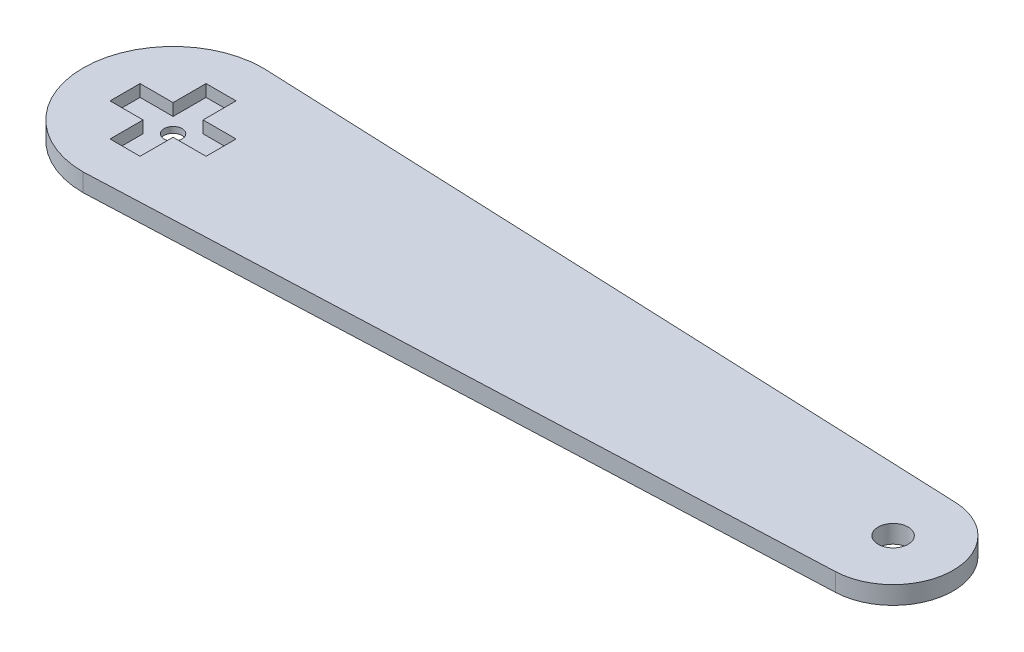
from build123d import *

# Parameters (mm, degrees)
SKETCH_1_R          = 5
EXTRUDE_1_DEPTH     = 3
SKETCH_2_R          = 2.5
CUT_EXTRUDE_1_DEPTH = 131.896905999
EXTRUDE_START       = -3
SKETCH_3_R          = 5
EXTRUDE_2_DEPTH     = 3
SKETCH_4_R          = 1.5
CUT_EXTRUDE_2_DEPTH = 3
SKETCH_5_W          = 5
SKETCH_5_H          = 5.5
SKETCH_5_W_2        = 5.5
SKETCH_5_H_2        = 5
SKETCH_5_R          = 1.5
CUT_EXTRUDE_3_DEPTH = 2


with BuildPart() as part:
    # 草图1 → 凸台-拉伸1 (new body)
    with BuildSketch(Plane(origin=(0, 0, 0), x_dir=(1, 0, 0), z_dir=(0, 1, 0))):
        with BuildLine():
            Line((0, -15), (120.415586748, -9.991360651))
            ThreePointArc((120.415586748, -9.991360651), (130, 0), (120.415586748, 9.991360651))
            Line((120.415586748, 9.991360651), (0, 15))
            ThreePointArc((0, 15), (-15, 0), (0, -15))
        make_face()
        with Locations(Location((0, 0, 0), (0, 0, 270))):
            Circle(SKETCH_1_R, mode=Mode.SUBTRACT)
    extrude(amount=EXTRUDE_1_DEPTH)

    # 草图2 → 切除-拉伸1 (cut, through all)
    with BuildSketch(Plane(origin=(0, 3, 0), x_dir=(1, 0, 0), z_dir=(0, 1, 0))):
        with Locations(Location((120, 0, 0), (0, 0, 270))):
            Circle(SKETCH_2_R)
    extrude(amount=-CUT_EXTRUDE_1_DEPTH, mode=Mode.SUBTRACT)

    # 草图3 → 凸台-拉伸2 (add)
    with BuildSketch(Plane(origin=(0, 3, 0), x_dir=(1, 0, 0), z_dir=(0, 1, 0)).offset(EXTRUDE_START)):
        Circle(SKETCH_3_R)
    extrude(amount=EXTRUDE_2_DEPTH)

    # 草图4 → 切除-拉伸2 (cut)
    with BuildSketch(Plane(origin=(0, 3, 0), x_dir=(1, 0, 0), z_dir=(0, 1, 0))):
        with Locations(Location((0, 0, 0), (0, 0, 270))):
            Circle(SKETCH_4_R)
    extrude(amount=-CUT_EXTRUDE_2_DEPTH, mode=Mode.SUBTRACT)

    # 草图5 → 切除-拉伸3 (cut)
    # profile 1 of 5: a face of its own
    with BuildSketch(Plane(origin=(0, 3, 0), x_dir=(1, 0, 0), z_dir=(0, 1, 0))):
        with Locations((0, 5.25)):
            Rectangle(SKETCH_5_W, SKETCH_5_H)
    # profile 2 of 5: a face of its own
    with BuildSketch(Plane(origin=(0, 3, 0), x_dir=(1, 0, 0), z_dir=(0, 1, 0))):
        with Locations((-5.25, 0)):
            Rectangle(SKETCH_5_W_2, SKETCH_5_H_2)
    # profile 3 of 5: a face of its own
    with BuildSketch(Plane(origin=(0, 3, 0), x_dir=(1, 0, 0), z_dir=(0, 1, 0))):
        with Locations((0, -5.25)):
            Rectangle(SKETCH_5_W, SKETCH_5_H)
    # profile 4 of 5: a face of its own
    with BuildSketch(Plane(origin=(0, 3, 0), x_dir=(1, 0, 0), z_dir=(0, 1, 0))):
        with Locations((5.25, 0)):
            Rectangle(SKETCH_5_W_2, SKETCH_5_H_2)
    # profile 5 of 5: a face of its own
    with BuildSketch(Plane(origin=(0, 3, 0), x_dir=(1, 0, 0), z_dir=(0, 1, 0))):
        Rectangle(SKETCH_5_W, SKETCH_5_H_2)
        with Locations(Location((0, 0, 0), (0, 0, 270))):
            Circle(SKETCH_5_R, mode=Mode.SUBTRACT)
    extrude(amount=-CUT_EXTRUDE_3_DEPTH, mode=Mode.SUBTRACT)


solid = part.part
